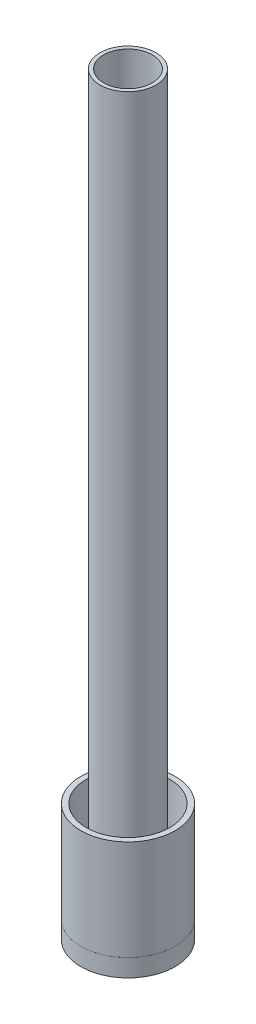
from build123d import *

# Parameters (mm, degrees)
SKETCH1_R                = 30.1625
SKETCH1_R_2              = 26.2509
BOSS_EXTRUDE1_DEPTH      = 762
BOSS_EXTRUDE2_DEPTH      = 76.2
BOSS_EXTRUDE2_DEPTH_BACK = 31.75
SKETCH1_4_R              = 50.8
SKETCH1_4_R_2            = 45.0596
SKETCH3_R                = 7.62
CUT_EXTRUDE1_DEPTH       = 28.575
CUT_EXTRUDE2_START       = -9.525
SKETCH3_4_R              = 3.81
CUT_EXTRUDE2_DEPTH       = 22.225
CUT_EXTRUDE3_START       = -9.525
CUT_EXTRUDE3_DEPTH       = 6.35


with BuildPart() as part:
    # Sketch1 → Boss-Extrude1 (new body)
    with BuildSketch(Plane(origin=(0, 0, 0), x_dir=(1, 0, 0), z_dir=(0, 1, 0))):
        with Locations(Location((0, 0, 0), (0, 0, 270))):
            Circle(SKETCH1_R)
        with Locations(Location((0, 0, 0), (0, 0, 270))):
            Circle(SKETCH1_R_2, mode=Mode.SUBTRACT)
    extrude(amount=BOSS_EXTRUDE1_DEPTH)


with BuildPart() as body_2:
    # Sketch1<4> → Boss-Extrude2 (new, two sides: drawn at the far end of the back side and taken through both)
    with BuildSketch(Plane(origin=(0, 0, 0), x_dir=(1, 0, 0), z_dir=(0, 1, 0)).offset(-BOSS_EXTRUDE2_DEPTH_BACK)):
        with Locations(Location((0, 0, 0), (0, 0, 270))):
            Circle(SKETCH1_4_R)
        with Locations(Location((0, 0, 0), (0, 0, 270))):
            Circle(SKETCH1_4_R_2, mode=Mode.SUBTRACT)
    extrude(amount=BOSS_EXTRUDE2_DEPTH + BOSS_EXTRUDE2_DEPTH_BACK)


with BuildPart() as body_3:
    # Sketch2 → Revolve1 (revolve)
    with BuildSketch(Plane.XY, mode=Mode.PRIVATE) as revolve1_sk:
        Polygon((43.861574388, -9.927263714), (44.7596, -10.825289326), (44.7596, -12.7), (0, -12.7), (0, 0), (44.7596, 0), (44.7596, -1.874710674), (43.861574388, -2.772736286), (44.7596, -3.670761898), (44.7596, -9.029238102), align=None)
        Polygon((5.207, -22.86), (3.175, -26.67), (3.175, -50.8), (50.8, -50.8), (50.8, -31.75), (44.9096, -31.75), (44.9096, -19.05), (5.207, -19.05), align=None)
    revolve(revolve1_sk.sketch.rotate(Axis((0, 0, 0), (0, -1, 0)), 180), axis=Axis((0, 0, 0), (0, -1, 0)))

    # Sketch3 → Cut-Extrude1 (cut)
    with BuildSketch(Plane.XZ.offset(50.8)):
        with Locations((-25.4, 0)):
            Circle(SKETCH3_R)
    extrude(amount=-CUT_EXTRUDE1_DEPTH, mode=Mode.SUBTRACT)

    # Sketch3<4> → Cut-Extrude2 (cut)
    with BuildSketch(Plane.XZ.offset(50.8).offset(CUT_EXTRUDE2_START)):
        with Locations((-25.4, 15.24)):
            Circle(SKETCH3_4_R)
        with Locations((-25.4, -15.24)):
            Circle(SKETCH3_4_R)
    extrude(amount=-CUT_EXTRUDE2_DEPTH, mode=Mode.SUBTRACT)

    # Sketch3<5> → Cut-Extrude3 (cut)
    with BuildSketch(Plane.XZ.offset(50.8).offset(CUT_EXTRUDE3_START)):
        with BuildLine():
            Line((-21.59, 6.599113577), (-21.59, 15.24))
            ThreePointArc((-21.59, 15.24), (-25.4, 11.43), (-29.21, 15.24))
            Line((-29.21, 15.24), (-29.21, 6.599113577))
            ThreePointArc((-29.21, 6.599113577), (-25.4, 7.62), (-21.59, 6.599113577))
        make_face()
        with BuildLine():
            Line((-21.59, -15.24), (-21.59, -6.599113577))
            ThreePointArc((-21.59, -6.599113577), (-25.4, -7.62), (-29.21, -6.599113577))
            Line((-29.21, -6.599113577), (-29.21, -15.24))
            ThreePointArc((-29.21, -15.24), (-25.4, -11.43), (-21.59, -15.24))
        make_face()
    extrude(amount=-CUT_EXTRUDE3_DEPTH, mode=Mode.SUBTRACT)


with BuildPart() as body_4:
    # Sketch4 → Revolve2 (revolve)
    with BuildSketch(Plane.XY, mode=Mode.PRIVATE) as revolve2_sk:
        with BuildLine():
            Line((-22.86, -60.706), (-22.86, -50.8))
            Line((-22.86, -50.8), (-22.86, -44.069))
            Line((-22.86, -44.069), (-18.25625, -44.069))
            Line((-18.25625, -44.069), (-18.25625, -43.59275))
            ThreePointArc((-18.25625, -43.59275), (-19.05, -42.799), (-18.25625, -42.00525))
            Line((-18.25625, -42.00525), (-18.25625, -34.19475))
            ThreePointArc((-18.25625, -34.19475), (-19.05, -33.401), (-18.25625, -32.60725))
            Line((-18.25625, -32.60725), (-18.25625, -32.131))
            Line((-18.25625, -32.131), (-25.4, -32.131))
            Line((-25.4, -32.131), (-25.4, -60.706))
            Line((-25.4, -60.706), (-22.86, -60.706))
        make_face()
    revolve(revolve2_sk.sketch.rotate(Axis((-25.4, -67.051041082, 0), (0, 1, 0)), 90), axis=Axis((-25.4, -67.051041082, 0), (0, 1, 0)))


solid = Compound([part.part, body_2.part, body_3.part, body_4.part])
